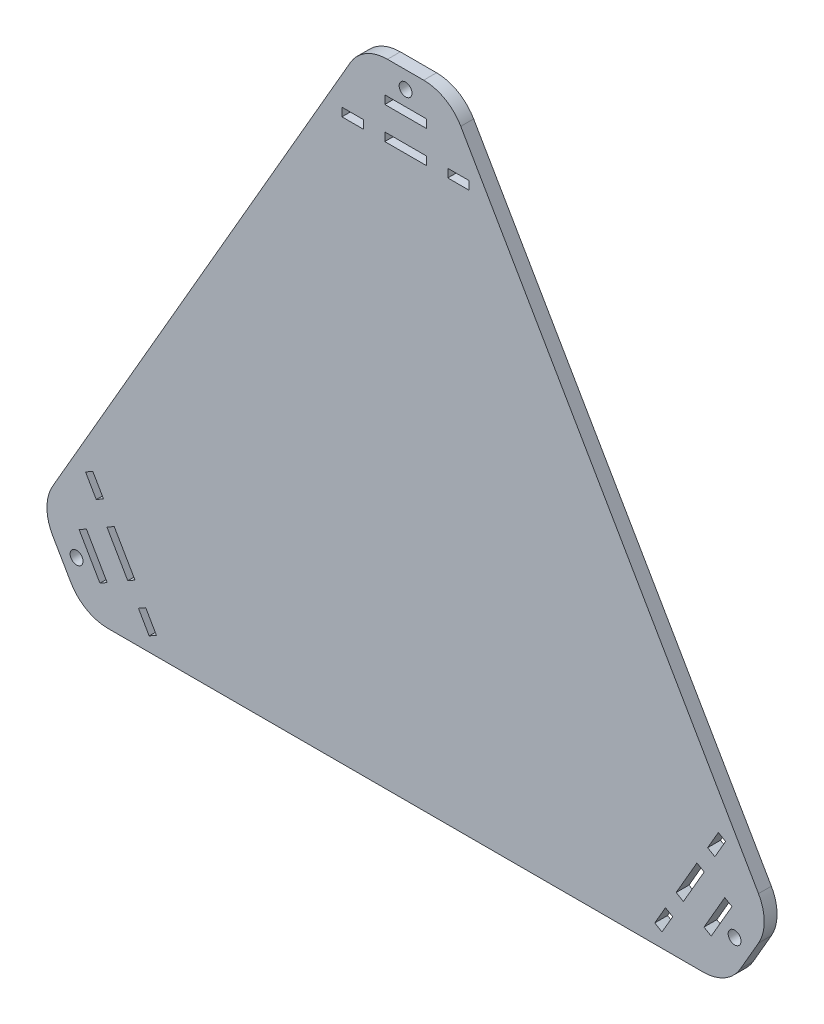
from build123d import *

# Parameters (mm, degrees)
SKETCH_1_R      = 1.5
SKETCH_1_W      = 9.7
SKETCH_1_H      = 1.95
SKETCH_1_W_2    = 5
EXTRUDE_1_DEPTH = 3


with BuildPart() as part:
    # Эскиз1 → Бобышка-Вытянуть1 (new body)
    with BuildSketch(Plane.XY):
        with BuildLine():
            Line((-69.489291724, -55), (69.489291724, -55))
            ThreePointArc((69.489291724, -55), (74.489291724, -53.660254038), (78.149545762, -50))
            Line((78.149545762, -50), (82.37604307, -42.679491924))
            ThreePointArc((82.37604307, -42.679491924), (83.715789032, -37.679491924), (82.37604307, -32.679491924))
            Line((82.37604307, -32.679491924), (12.886751346, 87.679491924))
            ThreePointArc((12.886751346, 87.679491924), (9.226497308, 91.339745962), (4.226497308, 92.679491924))
            Line((4.226497308, 92.679491924), (-4.226497308, 92.679491924))
            ThreePointArc((-4.226497308, 92.679491924), (-9.226497308, 91.339745962), (-12.886751346, 87.679491924))
            Line((-12.886751346, 87.679491924), (-82.37604307, -32.679491924))
            ThreePointArc((-82.37604307, -32.679491924), (-83.715789032, -37.679491924), (-82.37604307, -42.679491924))
            Line((-82.37604307, -42.679491924), (-78.149545762, -50))
            ThreePointArc((-78.149545762, -50), (-74.489291724, -53.660254038), (-69.489291724, -55))
        make_face()
        with Locations((-76.798692801, -44.339745962)):
            Circle(SKETCH_1_R, mode=Mode.SUBTRACT)
        with Locations(Location((0, 88.679491924, 0), (0, 0, 180))):
            Circle(SKETCH_1_R, mode=Mode.SUBTRACT)
        with Locations((76.798692801, -44.339745962)):
            Circle(SKETCH_1_R, mode=Mode.SUBTRACT)
        Polygon((-71.342603888, -46.789969171), (-76.192603888, -38.389522754), (-74.503854351, -37.414522754), (-69.653854351, -45.814969171), align=None, mode=Mode.SUBTRACT)
        with Locations((0, 84.204491924)):
            Rectangle(SKETCH_1_W, SKETCH_1_H, mode=Mode.SUBTRACT)
        Polygon((76.192603888, -38.389522754), (71.342603888, -46.789969171), (69.653854351, -45.814969171), (74.503854351, -37.414522754), align=None, mode=Mode.SUBTRACT)
        Polygon((-64.84741336, -43.039969171), (-69.69741336, -34.639522754), (-68.008663822, -33.664522754), (-63.158663822, -42.064969171), align=None, mode=Mode.SUBTRACT)
        with Locations((0, 76.704491924)):
            Rectangle(SKETCH_1_W, SKETCH_1_H, mode=Mode.SUBTRACT)
        Polygon((69.69741336, -34.639522754), (64.84741336, -43.039969171), (63.158663822, -42.064969171), (68.008663822, -33.664522754), align=None, mode=Mode.SUBTRACT)
        Polygon((70.508663822, -29.334395735), (72.19741336, -30.309395735), (74.69741336, -25.979268716), (73.008663822, -25.004268716), align=None, mode=Mode.SUBTRACT)
        Polygon((62.34741336, -47.370096189), (59.84741336, -51.700223208), (58.158663822, -50.725223208), (60.658663822, -46.395096189), align=None, mode=Mode.SUBTRACT)
        with Locations((-12.35, 76.704491924)):
            Rectangle(SKETCH_1_W_2, SKETCH_1_H, mode=Mode.SUBTRACT)
        with Locations((12.35, 76.704491924)):
            Rectangle(SKETCH_1_W_2, SKETCH_1_H, mode=Mode.SUBTRACT)
        Polygon((-60.658663822, -46.395096189), (-62.34741336, -47.370096189), (-59.84741336, -51.700223208), (-58.158663822, -50.725223208), align=None, mode=Mode.SUBTRACT)
        Polygon((-70.508663822, -29.334395735), (-73.008663822, -25.004268716), (-74.69741336, -25.979268716), (-72.19741336, -30.309395735), align=None, mode=Mode.SUBTRACT)
    extrude(amount=EXTRUDE_1_DEPTH)


solid = part.part
